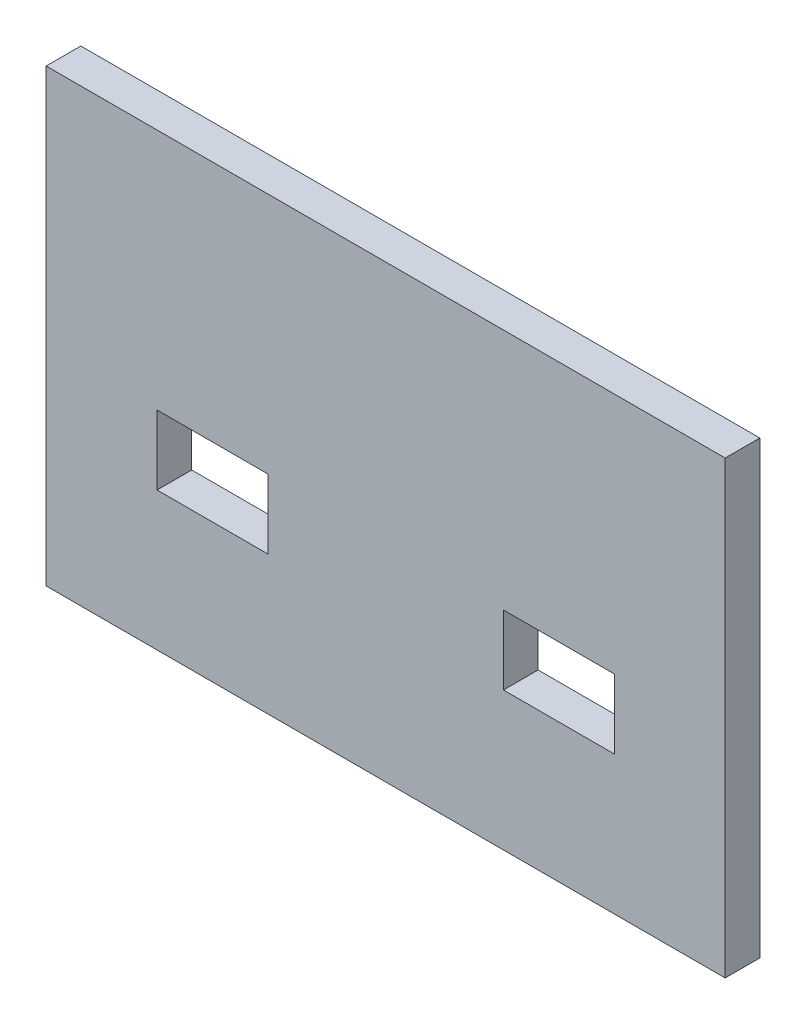
from build123d import *

# Parameters (mm, degrees)
SKETCH1_W           = 98
SKETCH1_H           = 65
BOSS_EXTRUDE1_DEPTH = 5
SKETCH2_W           = 16
SKETCH2_H           = 10
CUT_EXTRUDE1_DEPTH  = 15


with BuildPart() as part:
    # Sketch1 → Boss-Extrude1 (new body)
    with BuildSketch(Plane.XY):
        with Locations((49, -32.5)):
            Rectangle(SKETCH1_W, SKETCH1_H)
    extrude(amount=BOSS_EXTRUDE1_DEPTH)

    # Sketch2 → Cut-Extrude1 (cut)
    with BuildSketch(Plane.XY.offset(5)):
        Polygon((82, -45), (82, -40), (82, -35), (66, -35), (66, -45), align=None)
        with Locations((24, -40)):
            Rectangle(SKETCH2_W, SKETCH2_H)
    extrude(amount=-CUT_EXTRUDE1_DEPTH, mode=Mode.SUBTRACT)


solid = part.part
